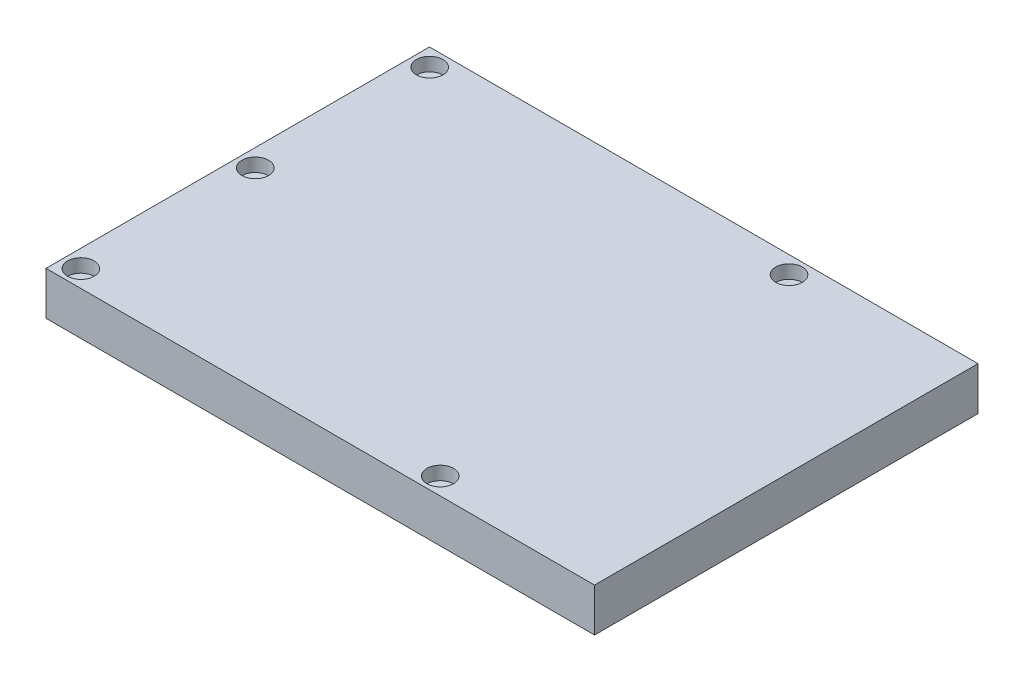
from build123d import *

# Parameters (mm, degrees)
SKETCH1_W           = 126.673172486
SKETCH1_H           = 88.54897829
BOSS_EXTRUDE1_DEPTH = 10
SKETCH2_R           = 3.075
CUT_EXTRUDE1_DEPTH  = 3.1


with BuildPart() as part:
    # Sketch1 → Boss-Extrude1 (new body)
    with BuildSketch(Plane(origin=(0, 0, 0), x_dir=(1, 0, 0), z_dir=(0, 1, 0))):
        Rectangle(SKETCH1_W, SKETCH1_H)
    extrude(amount=BOSS_EXTRUDE1_DEPTH)

    # Sketch2 → Cut-Extrude1 (cut)
    with BuildSketch(Plane(origin=(0, 10, 0), x_dir=(1, 0, 0), z_dir=(0, 1, 0))):
        with Locations(Location((-59.264642203, 40.249094368, 0), (0, 0, 270))):
            Circle(SKETCH2_R)
        with Locations(Location((-59.264642203, -0.024981571, 0), (0, 0, 270))):
            Circle(SKETCH2_R)
        with Locations(Location((-59.264642203, -40.299057509, 0), (0, 0, 270))):
            Circle(SKETCH2_R)
        with Locations(Location((23.719842676, -40.299057509, 0), (0, 0, 270))):
            Circle(SKETCH2_R)
        with Locations(Location((23.719842676, 40.249094368, 0), (0, 0, 270))):
            Circle(SKETCH2_R)
    extrude(amount=-CUT_EXTRUDE1_DEPTH, mode=Mode.SUBTRACT)


solid = part.part
